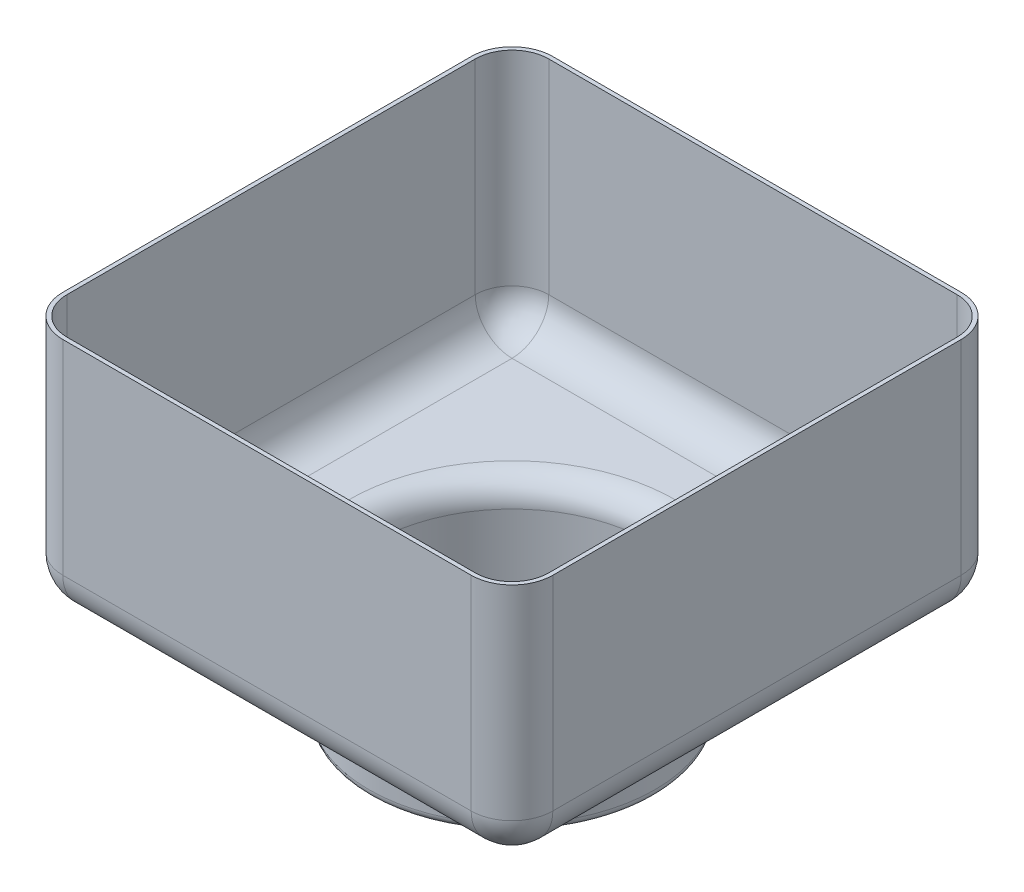
from build123d import *

# Parameters (mm, degrees)
SKETCH1_R           = 35
SKETCH1_R_2         = 25
BOSS_EXTRUDE1_DEPTH = 25
BOSS_EXTRUDE2_DEPTH = 60
FILLET2_R           = 10
FILLET3_R           = 5
FILLET4_R           = 2
SHELL1_T            = -1


with BuildPart() as part:
    # Sketch1 → Boss-Extrude1 (new body)
    # profile 1 of 2: a face of its own
    with BuildSketch(Plane(origin=(0, 0, 0), x_dir=(1, 0, 0), z_dir=(0, 1, 0))):
        with Locations(Location((-47.349258728, -4.926027286, 0), (0, 0, 270))):
            Circle(SKETCH1_R)
        with Locations((-47.349258728, -4.926027286)):
            Circle(SKETCH1_R_2, mode=Mode.SUBTRACT)
    # profile 2 of 2: a face of its own
    with BuildSketch(Plane(origin=(0, 0, 0), x_dir=(1, 0, 0), z_dir=(0, 1, 0))):
        with Locations((-47.349258728, -4.926027286)):
            Circle(SKETCH1_R_2)
    extrude(amount=BOSS_EXTRUDE1_DEPTH)

    # Sketch2 → Boss-Extrude2 (add)
    with BuildSketch(Plane(origin=(0, 25, 0), x_dir=(1, 0, 0), z_dir=(0, 1, 0))):
        with BuildLine():
            Line((-97.349258728, 55.073972714), (2.650741272, 55.073972714))
            ThreePointArc((2.650741272, 55.073972714), (9.721809084, 52.145040526), (12.650741272, 45.073972714))
            Line((12.650741272, 45.073972714), (12.650741272, -54.926027286))
            ThreePointArc((12.650741272, -54.926027286), (9.721809084, -61.997095098), (2.650741272, -64.926027286))
            Line((2.650741272, -64.926027286), (-97.349258728, -64.926027286))
            ThreePointArc((-97.349258728, -64.926027286), (-104.42032654, -61.997095098), (-107.349258728, -54.926027286))
            Line((-107.349258728, -54.926027286), (-107.349258728, 45.073972714))
            ThreePointArc((-107.349258728, 45.073972714), (-104.42032654, 52.145040526), (-97.349258728, 55.073972714))
        make_face()
    extrude(amount=BOSS_EXTRUDE2_DEPTH)

    # Fillet2
    fillet2_edges = [part.edges().sort_by_distance(p)[0] for p in [
        (-104.42032654, 25, -52.145040526),
        (-107.349258728, 25, 4.926027286),
        (-104.42032654, 25, 61.997095098),
        (-47.349258728, 25, 64.926027286),
        (9.721809084, 25, 61.997095098),
        (12.650741272, 25, 4.926027286),
        (9.721809084, 25, -52.145040526),
        (-47.349258728, 25, -55.073972714),
    ]]
    fillet(fillet2_edges, radius=FILLET2_R)

    # Fillet3
    fillet3_edges = [part.edges().sort_by_distance(p)[0] for p in [
        (-47.349258728, 25, -30.073972714),
    ]]
    fillet(fillet3_edges, radius=FILLET3_R)

    # Fillet4
    fillet4_edges = [part.edges().sort_by_distance(p)[0] for p in [
        (-47.349258728, 0, -30.073972714),
    ]]
    fillet(fillet4_edges, radius=FILLET4_R)

    # Shell1
    shell1_openings = [part.faces().sort_by_distance(p)[0] for p in [
        (-47.349258728, 85, 4.926027286),
    ]]
    offset(amount=SHELL1_T, openings=shell1_openings, kind=Kind.INTERSECTION)


solid = part.part
